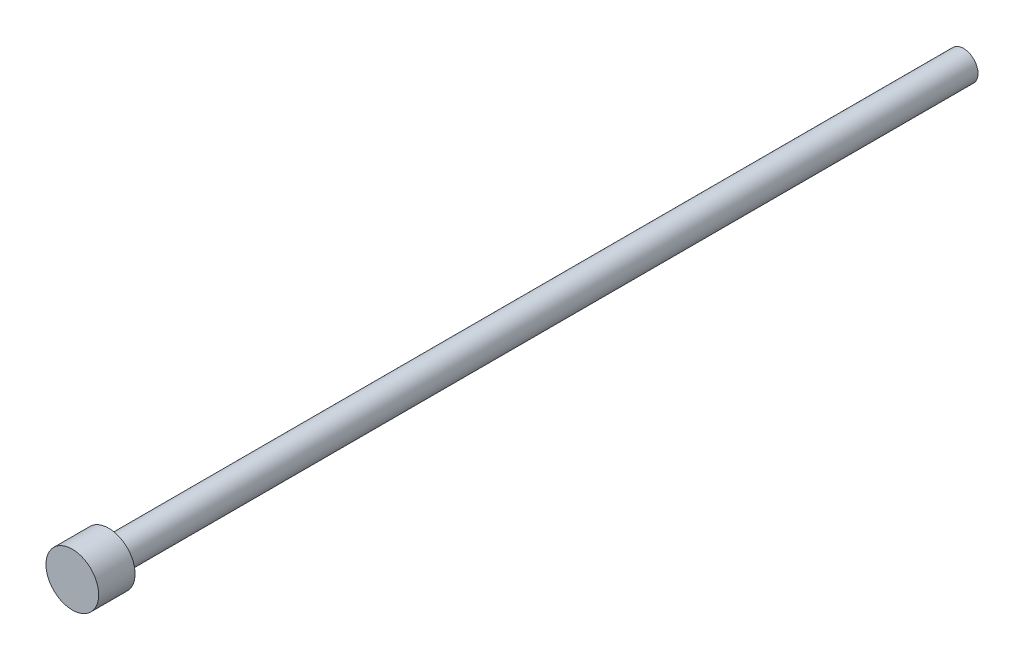
from build123d import *

# Parameters (mm, degrees)
SKETCH2_R           = 2.03835
BOSS_EXTRUDE1_DEPTH = 119.38
SKETCH3_R           = 3.683
BOSS_EXTRUDE2_DEPTH = 5.08


with BuildPart() as part:
    # Sketch2 → Boss-Extrude1 (new body)
    with BuildSketch(Plane.XY):
        with Locations(Location((0, 0, 0), (0, 0, 180))):
            Circle(SKETCH2_R)
    extrude(amount=BOSS_EXTRUDE1_DEPTH)

    # Sketch3 → Boss-Extrude2 (add)
    with BuildSketch(Plane.XY.offset(119.38)):
        Circle(SKETCH3_R)
    extrude(amount=BOSS_EXTRUDE2_DEPTH)


solid = part.part
